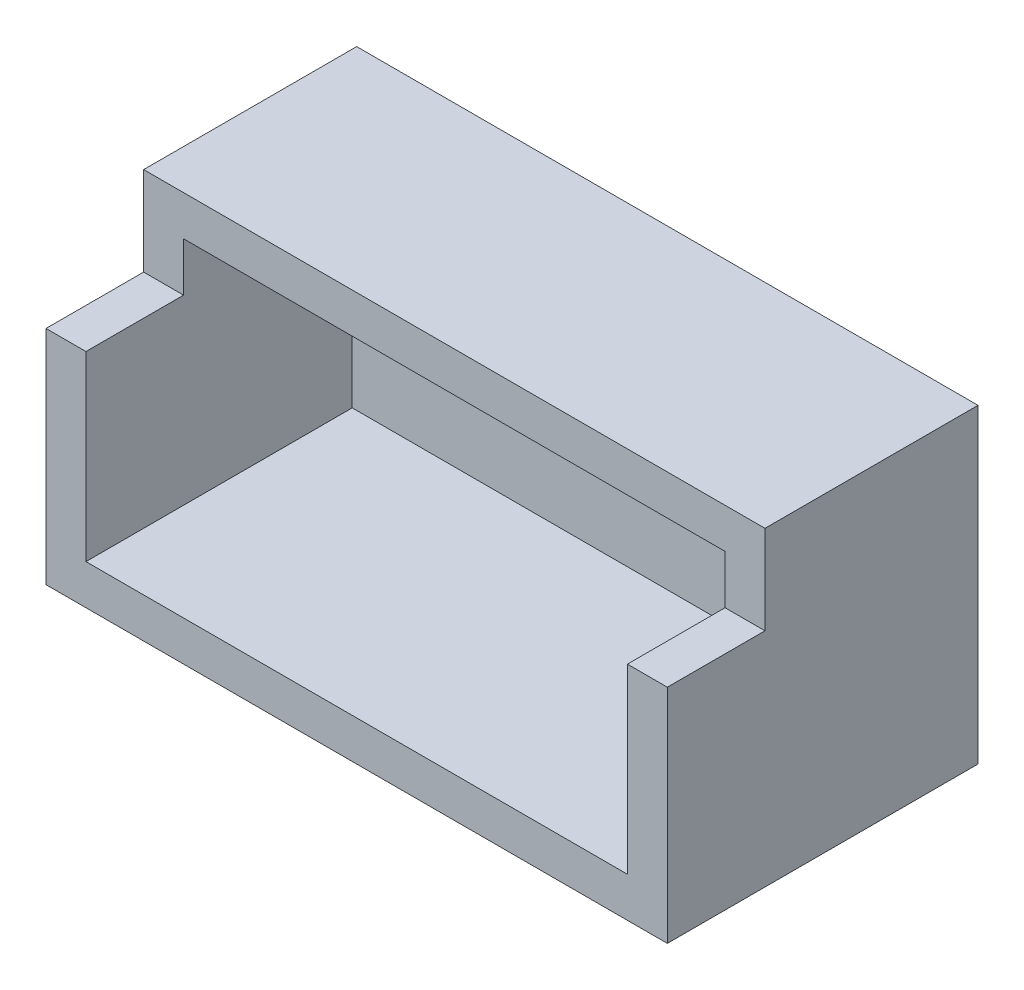
from build123d import *

# Parameters (mm, degrees)
SOFT_CONTACT_AND_WRAP_START      = -1
SOFT_CONTACT_AND_WRAP_PROFILE_W  = 14
SOFT_CONTACT_AND_WRAP_PROFILE_H  = 7
SOFT_CONTACT_AND_WRAP_DEPTH      = 7
FINGER_SLIP_POCKET_PROFILE_W     = 12.2
FINGER_SLIP_POCKET_PROFILE_H     = 5.2
OPEN_TOP_SLIP_POCKET_DEPTH       = 7
SERVO_EAR_SWEEP_RELIEF_START     = 3.8
SERVO_EAR_SWEEP_RELIEF_PROFILE_W = 16
SERVO_EAR_SWEEP_RELIEF_PROFILE_H = 3
SERVO_EAR_SWEEP_RELIEF_DEPTH     = 3.2
PAD_CAPTURE_M2_START             = -50
PAD_CAPTURE_M2_PROFILE_R         = 1.1
PAD_CAPTURE_M2_DEPTH             = 86.510561809


with BuildPart() as part:
    # Soft_contact_and_wrap_profile → Soft_contact_and_wrap (new body)
    with BuildSketch(Plane.XY.offset(SOFT_CONTACT_AND_WRAP_START)):
        with Locations((21, -17.5)):
            Rectangle(SOFT_CONTACT_AND_WRAP_PROFILE_W, SOFT_CONTACT_AND_WRAP_PROFILE_H)
    extrude(amount=SOFT_CONTACT_AND_WRAP_DEPTH)

    # Finger_slip_pocket_profile → Open_top_slip_pocket (cut)
    with BuildSketch(Plane.XY):
        with Locations((21, -17.5)):
            Rectangle(FINGER_SLIP_POCKET_PROFILE_W, FINGER_SLIP_POCKET_PROFILE_H)
    extrude(amount=OPEN_TOP_SLIP_POCKET_DEPTH, mode=Mode.SUBTRACT)

    # Servo_ear_sweep_relief_profile → Servo_ear_sweep_relief (cut)
    with BuildSketch(Plane.XY.offset(SERVO_EAR_SWEEP_RELIEF_START)):
        with Locations((21, -14.5)):
            Rectangle(SERVO_EAR_SWEEP_RELIEF_PROFILE_W, SERVO_EAR_SWEEP_RELIEF_PROFILE_H)
    extrude(amount=SERVO_EAR_SWEEP_RELIEF_DEPTH, mode=Mode.SUBTRACT)

    # Pad_capture_M2_profile → Pad_capture_M2 (cut, through all)
    with BuildSketch(Plane.XY.offset(PAD_CAPTURE_M2_START)):
        with Locations(Location((18, -17.5, 0), (0, 0, 180))):
            Circle(PAD_CAPTURE_M2_PROFILE_R)
        with Locations(Location((24, -17.5, 0), (0, 0, 180))):
            Circle(PAD_CAPTURE_M2_PROFILE_R)
    extrude(amount=PAD_CAPTURE_M2_DEPTH, mode=Mode.SUBTRACT)


solid = part.part
